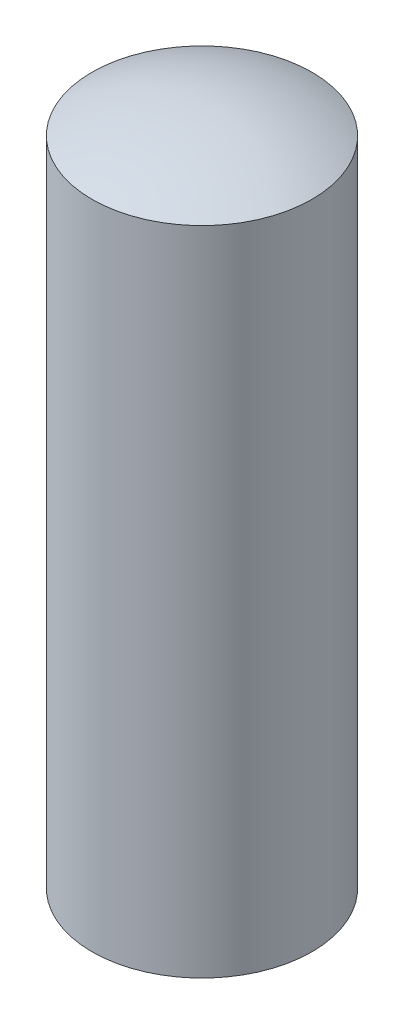
from build123d import *


with BuildPart() as part:
    # Sketch1 → Revolve1 (revolve)
    with BuildSketch(Plane.XY):
        with BuildLine():
            Line((5, -1.2), (5, -30.8))
            ThreePointArc((5, -30.8), (2.570992026, -31.69580011), (0, -32))
            Line((0, -32), (0, 0))
            ThreePointArc((0, 0), (2.570992026, -0.30419989), (5, -1.2))
        make_face()
    revolve(axis=Axis((0, 5, 0), (0, -1, 0)))


solid = part.part
